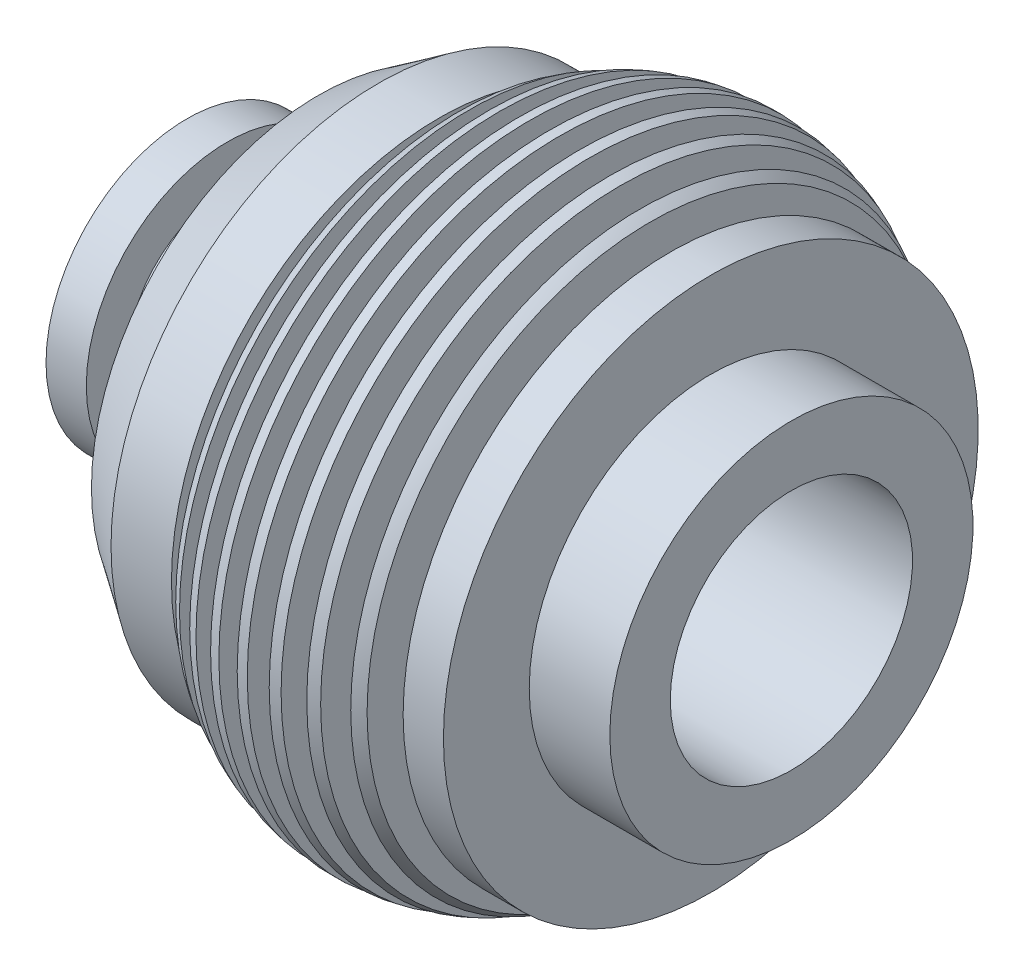
from build123d import *


with BuildPart() as part:
    # Sketch1 → Revolve1 (revolve)
    with BuildSketch(Plane.XY, mode=Mode.PRIVATE) as revolve1_sk:
        with BuildLine():
            ThreePointArc((25, 59.33620738), (26.242582391, 59.827647663), (27.5, 60.279782054))
            Line((27.5, 60.279782054), (27.5, 35.065472262))
            Line((27.5, 35.065472262), (32.5, 35.065472262))
            Line((32.5, 35.065472262), (32.5, 61.655024098))
            ThreePointArc((32.5, 61.655024098), (33.746649446, 61.897912685), (35, 62.103441501))
            Line((35, 62.103441501), (35, 35.065472262))
            Line((35, 35.065472262), (40, 35.065472262))
            Line((40, 35.065472262), (40, 62.547125869))
            ThreePointArc((40, 62.547125869), (41.25, 62.565512199), (42.5, 62.547125869))
            Line((42.5, 62.547125869), (42.5, 35.065472262))
            Line((42.5, 35.065472262), (47.5, 35.065472262))
            Line((47.5, 35.065472262), (47.5, 62.103441501))
            ThreePointArc((47.5, 62.103441501), (48.753350554, 61.897912685), (50, 61.655024098))
            Line((50, 61.655024098), (50, 35.065472262))
            Line((50, 35.065472262), (55, 35.065472262))
            Line((55, 35.065472262), (55, 60.279782054))
            ThreePointArc((55, 60.279782054), (56.257417609, 59.827647663), (57.5, 59.33620738))
            Line((57.5, 59.33620738), (57.5, 35.065472262))
            Line((57.5, 35.065472262), (62.5, 35.065472262))
            Line((62.5, 35.065472262), (62.5, 56.871591859))
            ThreePointArc((62.5, 56.871591859), (63.76354019, 56.112571831), (65, 55.310192648))
            Line((65, 55.310192648), (65, 35.065472262))
            Line((65, 35.065472262), (70, 35.065472262))
            Line((70, 35.065472262), (70, 51.365472262))
            Line((70, 51.365472262), (80, 51.365472262))
            Line((80, 51.365472262), (80, 30.065472262))
            Line((80, 30.065472262), (100, 30.065472262))
            Line((100, 30.065472262), (100, 15.065472262))
            Line((100, 15.065472262), (0, 15.065472262))
            Line((0, 15.065472262), (0, 0))
            Line((0, 0), (-21.679197995, 0))
            Line((-21.679197995, 0), (-50, 0))
            Line((-50, 0), (-50, 20))
            Line((-50, 20), (-40, 20))
            Line((-40, 20), (-40, 10))
            Line((-40, 10), (-27.422676306, 10))
            ThreePointArc((-27.422676306, 10), (-20.351608494, 12.928932188), (-17.422676306, 20))
            Line((-17.422676306, 20), (-17.422676306, 41.3))
            Line((-17.422676306, 41.3), (-2.5, 51.365472262))
            Line((-2.5, 51.365472262), (12.5, 51.365472262))
            Line((12.5, 51.365472262), (12.5, 35.065472262))
            Line((12.5, 35.065472262), (17.5, 35.065472262))
            Line((17.5, 35.065472262), (17.5, 55.310192648))
            ThreePointArc((17.5, 55.310192648), (18.73645981, 56.112571831), (20, 56.871591859))
            Line((20, 56.871591859), (20, 35.065472262))
            Line((20, 35.065472262), (25, 35.065472262))
            Line((25, 35.065472262), (25, 59.33620738))
        make_face()
    revolve(revolve1_sk.sketch.rotate(Axis((-50, -15, 0), (1, 0, 0)), 90), axis=Axis((-50, -15, 0), (1, 0, 0)))


solid = part.part
